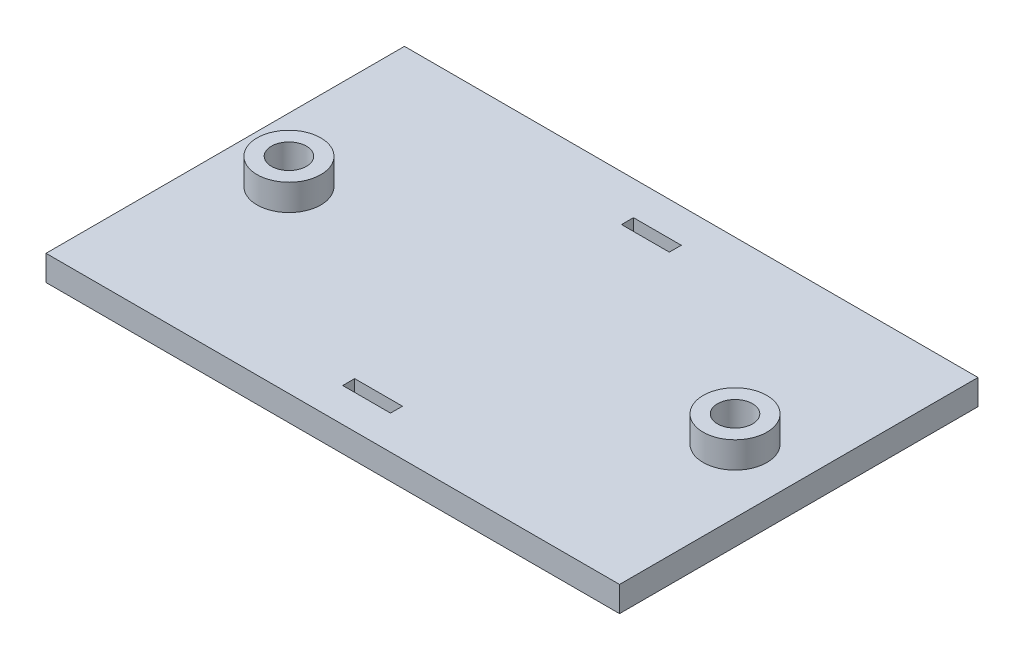
from build123d import *

# Parameters (mm, degrees)
PLATE_START      = 92.57
PLATE_SKETCH_W   = 72
PLATE_SKETCH_H   = 45
PLATE_SKETCH_R   = 2.2
PLATE_SKETCH_W_2 = 6
PLATE_SKETCH_H_2 = 1.5
PLATE_DEPTH      = 3.18
PADS_START       = 95.75
PADS_SKETCH_R    = 4
PADS_SKETCH_R_2  = 2.2
PADS_DEPTH       = 3.3


with BuildPart() as part:
    # Plate Sketch → Plate (new body)
    with BuildSketch(Plane(origin=(0, 0, 0), x_dir=(1, 0, 0), z_dir=(0, 1, 0)).offset(PLATE_START)):
        Rectangle(PLATE_SKETCH_W, PLATE_SKETCH_H)
        with Locations((-28, 0)):
            Circle(PLATE_SKETCH_R, mode=Mode.SUBTRACT)
        with Locations((28, 0)):
            Circle(PLATE_SKETCH_R, mode=Mode.SUBTRACT)
        with Locations((0, 17.5)):
            Rectangle(PLATE_SKETCH_W_2, PLATE_SKETCH_H_2, mode=Mode.SUBTRACT)
        with Locations((0, -17.5)):
            Rectangle(PLATE_SKETCH_W_2, PLATE_SKETCH_H_2, mode=Mode.SUBTRACT)
    extrude(amount=PLATE_DEPTH)

    # Pads Sketch → Pads (add)
    # profile 1 of 2: a face of its own
    with BuildSketch(Plane(origin=(0, 0, 0), x_dir=(1, 0, 0), z_dir=(0, 1, 0)).offset(PADS_START)):
        with Locations((-28, 0)):
            Circle(PADS_SKETCH_R)
        with Locations((-28, 0)):
            Circle(PADS_SKETCH_R_2, mode=Mode.SUBTRACT)
    # profile 2 of 2: a face of its own
    with BuildSketch(Plane(origin=(0, 0, 0), x_dir=(1, 0, 0), z_dir=(0, 1, 0)).offset(PADS_START)):
        with Locations((28, 0)):
            Circle(PADS_SKETCH_R)
        with Locations((28, 0)):
            Circle(PADS_SKETCH_R_2, mode=Mode.SUBTRACT)
    extrude(amount=PADS_DEPTH)


solid = part.part
